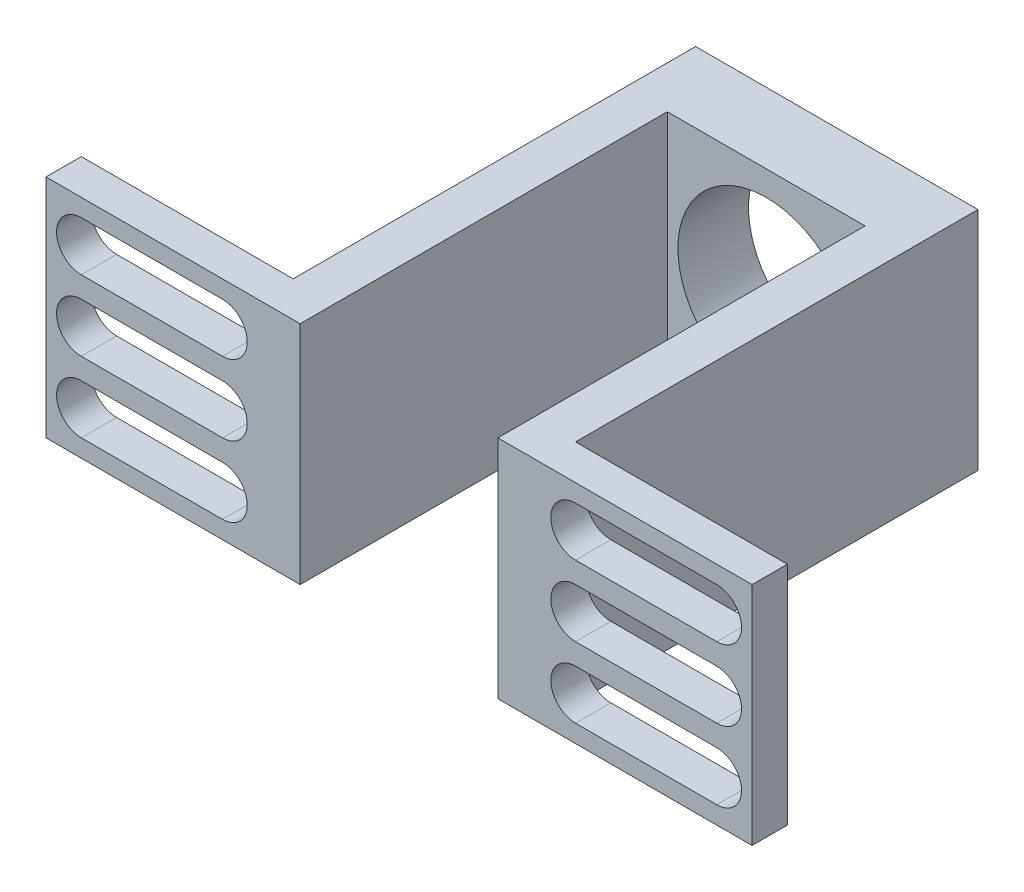
from build123d import *

# Parameters (mm, degrees)
SKETCH1_W           = 20
SKETCH1_H           = 16
SKETCH1_R           = 6.25
BOSS_EXTRUDE1_DEPTH = 5
SKETCH2_W           = 3
SKETCH2_H           = 16
BOSS_EXTRUDE2_DEPTH = 26
SKETCH3_W           = 18
SKETCH3_H           = 16
BOSS_EXTRUDE3_DEPTH = 2.5
CUT_EXTRUDE1_DEPTH  = 39.745967532


with BuildPart() as part:
    # Sketch1 → Boss-Extrude1 (new body)
    with BuildSketch(Plane.XY):
        Rectangle(SKETCH1_W, SKETCH1_H)
        Circle(SKETCH1_R, mode=Mode.SUBTRACT)
    extrude(amount=BOSS_EXTRUDE1_DEPTH)

    # Sketch2 → Boss-Extrude2 (add)
    with BuildSketch(Plane.XY.offset(5)):
        with Locations((-8.5, 0)):
            Rectangle(SKETCH2_W, SKETCH2_H)
        with Locations((8.5, 0)):
            Rectangle(SKETCH2_W, SKETCH2_H)
    extrude(amount=BOSS_EXTRUDE2_DEPTH)

    # Sketch3 → Boss-Extrude3 (add)
    with BuildSketch(Plane.XY.offset(31)):
        with Locations((-16, 0)):
            Rectangle(SKETCH3_W, SKETCH3_H)
        with Locations((16, 0)):
            Rectangle(SKETCH3_W, SKETCH3_H)
    extrude(amount=-BOSS_EXTRUDE3_DEPTH)

    # Sketch4 → Cut-Extrude1 (cut, through all)
    with BuildSketch(Plane(origin=(0, 0, 28.5), x_dir=(-1, 0, 0), z_dir=(0, 0, -1))):
        with BuildLine():
            Line((-22.5, -3.25), (-12.5, -3.25))
            ThreePointArc((-12.5, -3.25), (-10.75, -5), (-12.5, -6.75))
            Line((-12.5, -6.75), (-22.5, -6.75))
            ThreePointArc((-22.5, -6.75), (-24.25, -5), (-22.5, -3.25))
        make_face()
        with BuildLine():
            Line((22.5, 6.75), (12.5, 6.75))
            ThreePointArc((12.5, 6.75), (10.75, 5), (12.5, 3.25))
            Line((12.5, 3.25), (22.5, 3.25))
            ThreePointArc((22.5, 3.25), (24.25, 5), (22.5, 6.75))
        make_face()
        with BuildLine():
            Line((-22.5, 1.75), (-12.5, 1.75))
            ThreePointArc((-12.5, 1.75), (-10.75, 0), (-12.5, -1.75))
            Line((-12.5, -1.75), (-22.5, -1.75))
            ThreePointArc((-22.5, -1.75), (-24.25, 0), (-22.5, 1.75))
        make_face()
        with BuildLine():
            Line((-22.5, 6.75), (-12.5, 6.75))
            ThreePointArc((-12.5, 6.75), (-10.75, 5), (-12.5, 3.25))
            Line((-12.5, 3.25), (-22.5, 3.25))
            ThreePointArc((-22.5, 3.25), (-24.25, 5), (-22.5, 6.75))
        make_face()
        with BuildLine():
            Line((22.5, 1.75), (12.5, 1.75))
            ThreePointArc((12.5, 1.75), (10.75, 0), (12.5, -1.75))
            Line((12.5, -1.75), (22.5, -1.75))
            ThreePointArc((22.5, -1.75), (24.25, 0), (22.5, 1.75))
        make_face()
        with BuildLine():
            Line((22.5, -3.25), (12.5, -3.25))
            ThreePointArc((12.5, -3.25), (10.75, -5), (12.5, -6.75))
            Line((12.5, -6.75), (22.5, -6.75))
            ThreePointArc((22.5, -6.75), (24.25, -5), (22.5, -3.25))
        make_face()
    extrude(amount=-CUT_EXTRUDE1_DEPTH, mode=Mode.SUBTRACT)


solid = part.part
